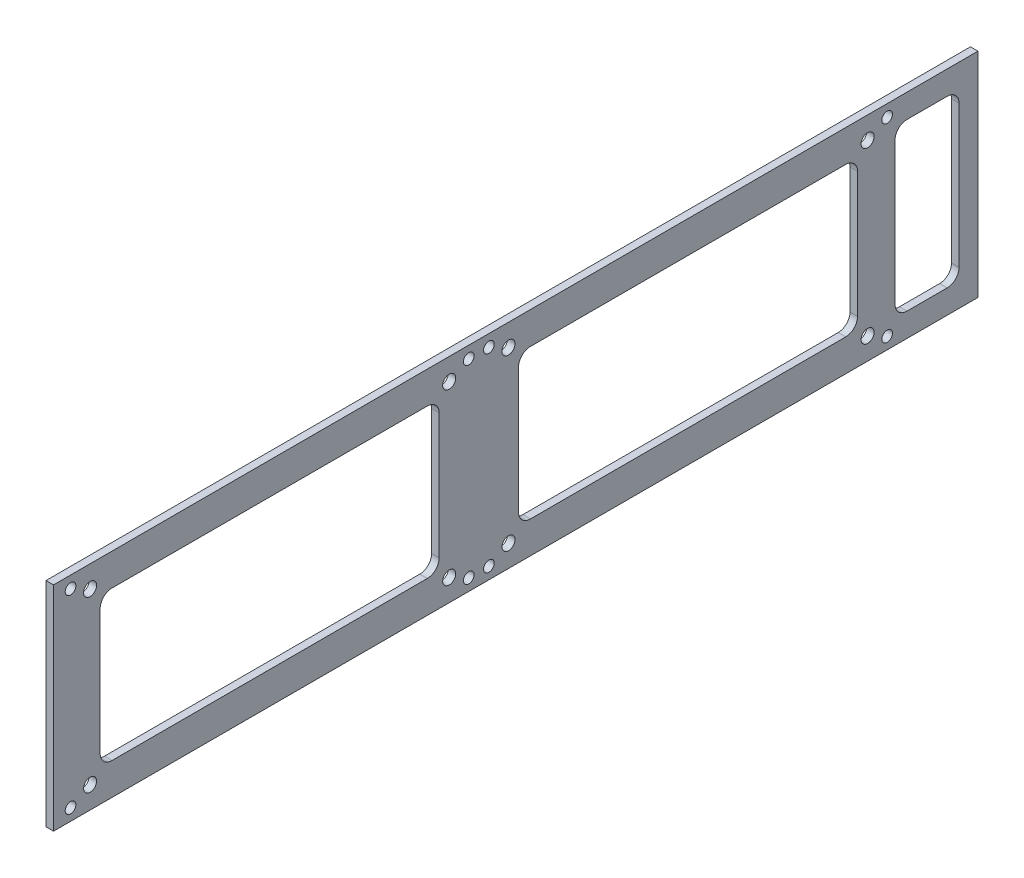
from build123d import *

# Parameters (mm, degrees)
SKETCH1_W            = 390
SKETCH1_H            = 90
BOSS_EXTRUDE1_DEPTH  = 3.175
SKETCH2_W            = 143
SKETCH2_H            = 63
CUT_EXTRUDE1_DEPTH   = 3.175
M5_CLEARANCE_HOLE1_D = 5.5
SKETCH6_W            = 27
SKETCH6_H            = 70
CUT_EXTRUDE2_DEPTH   = 3.175
M4_CLEARANCE_HOLE2_D = 4.5
FILLET1_R            = 5


with BuildPart() as part:
    # Sketch1 → Boss-Extrude1 (new body)
    with BuildSketch(Plane(origin=(0, 0, 0), x_dir=(0, 0, -1), z_dir=(1, 0, 0))):
        Rectangle(SKETCH1_W, SKETCH1_H)
    extrude(amount=BOSS_EXTRUDE1_DEPTH)

    # Sketch2 → Cut-Extrude1 (cut)
    with BuildSketch(Plane(origin=(3.175, 0, 0), x_dir=(0, 0, -1), z_dir=(1, 0, 0))):
        with Locations((72.675, 0)):
            Rectangle(SKETCH2_W, SKETCH2_H)
        with Locations((-103.825, 0)):
            Rectangle(SKETCH2_W, SKETCH2_H)
    extrude(amount=-CUT_EXTRUDE1_DEPTH, mode=Mode.SUBTRACT)

    # M5 Clearance Hole1 (through all)
    with Locations(Plane(origin=(3.175, 0, 0), x_dir=(0, 0, -1), z_dir=(1, 0, 0))):
        with Locations((-103.825, 0), (-28.075, 35.75), (-179.575, -35.75), (-179.575, 35.75), (-28.075, -35.75), (72.675, 0), (148.425, 35.75), (-3.075, -35.75), (-3.075, 35.75), (148.425, -35.75)):
            Hole(M5_CLEARANCE_HOLE1_D / 2)

    # Sketch6 → Cut-Extrude2 (cut)
    with BuildSketch(Plane(origin=(3.175, 0, 0), x_dir=(0, 0, -1), z_dir=(1, 0, 0))):
        with Locations((173.5, 0)):
            Rectangle(SKETCH6_W, SKETCH6_H)
    extrude(amount=-CUT_EXTRUDE2_DEPTH, mode=Mode.SUBTRACT)

    # M4 Clearance Hole2 (through all)
    with Locations(Plane(origin=(3.175, 0, 0), x_dir=(0, 0, -1), z_dir=(1, 0, 0))):
        with Locations((-103.825, 0), (-19.825, 40), (-187.825, -40), (-187.825, 40), (-19.825, -40), (72.675, 0), (156.675, 40), (-11.325, -40), (-11.325, 40), (156.675, -40)):
            Hole(M4_CLEARANCE_HOLE2_D / 2)

    # Fillet1
    fillet1_edges = [part.edges().sort_by_distance(p)[0] for p in [
        (1.5875, 35, -187),
        (1.5875, -35, -187),
        (1.5875, -35, -160),
        (1.5875, 35, -160),
        (1.5875, 31.5, 32.325),
        (1.5875, -31.5, 32.325),
        (1.5875, -31.5, 175.325),
        (1.5875, 31.5, 175.325),
        (1.5875, 31.5, -144.175),
        (1.5875, -31.5, -144.175),
        (1.5875, -31.5, -1.175),
        (1.5875, 31.5, -1.175),
    ]]
    fillet(fillet1_edges, radius=FILLET1_R)


solid = part.part
